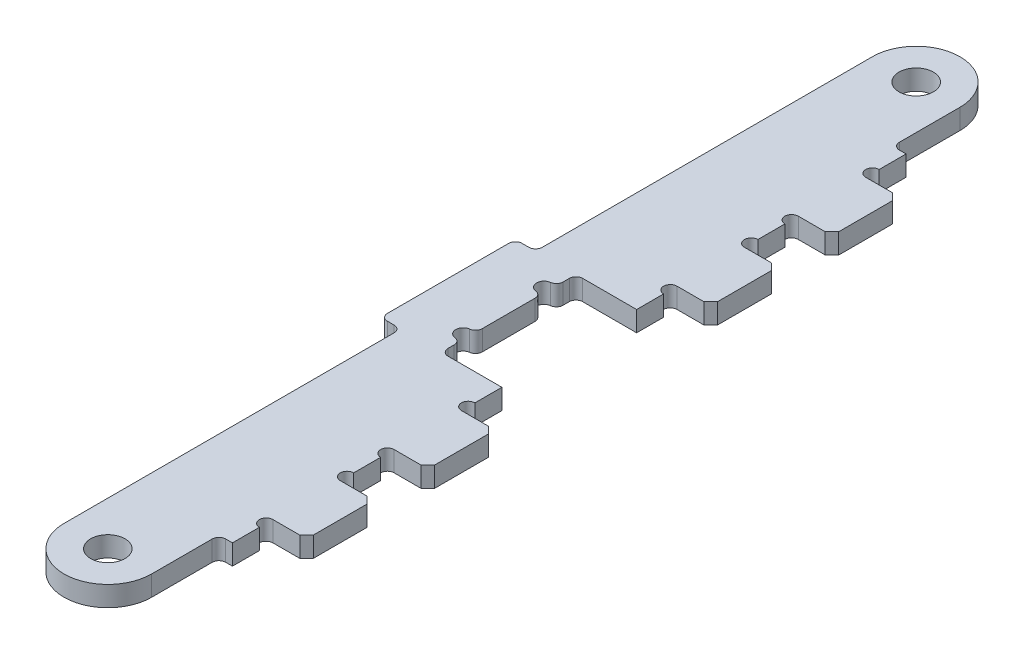
from build123d import *

# Parameters (mm, degrees)
SKETCH_1_R          = 6.5
SKETCH_1_R_2        = 2.55
SKETCH_1_W          = 3
SKETCH_1_H          = 20
EXTRUDE_1_DEPTH     = 3
FILLET_1_R          = 1
CHAMFER_1_SIZE      = 1
SKETCH_2_R          = 1.1
CUT_EXTRUDE_1_DEPTH = 68.922750239
FILLET_2_R          = 1


with BuildPart() as part:
    # 草图1 → 凸台-拉伸1 (new body)
    # profile 1 of 4: a face of its own
    with BuildSketch(Plane(origin=(0, 0, 0), x_dir=(1, 0, 0), z_dir=(0, 1, 0))):
        with BuildLine():
            ThreePointArc((6.5, 60), (0, 53.5), (-6.5, 60))
            Line((-6.5, 60), (-6.5, 10))
            Line((-6.5, 10), (-6.5, -10))
            Line((-6.5, -10), (-6.5, -60))
            ThreePointArc((-6.5, -60), (0, -53.5), (6.5, -60))
            Line((6.5, -60), (6.5, -50))
            Line((6.5, -50), (8.5, -50))
            Line((8.5, -50), (8.5, -46))
            ThreePointArc((8.5, -46), (7.5, -45), (8.5, -44))
            Line((8.5, -44), (13.5, -44))
            Line((13.5, -44), (13.5, -34))
            Line((13.5, -34), (8.5, -34))
            ThreePointArc((8.5, -34), (7.5, -33), (8.5, -32))
            Line((8.5, -32), (8.5, -28))
            ThreePointArc((8.5, -28), (7.5, -27), (8.5, -26))
            Line((8.5, -26), (13.5, -26))
            Line((13.5, -26), (13.5, -16))
            Line((13.5, -16), (8.5, -16))
            ThreePointArc((8.5, -16), (7.5, -15), (8.5, -14))
            Line((8.5, -14), (8.5, -10))
            Line((8.5, -10), (-0.5, -10))
            Line((-0.5, -10), (-0.5, 10))
            Line((-0.5, 10), (8.5, 10))
            Line((8.5, 10), (8.5, 14))
            ThreePointArc((8.5, 14), (7.5, 15), (8.5, 16))
            Line((8.5, 16), (13.5, 16))
            Line((13.5, 16), (13.5, 26))
            Line((13.5, 26), (8.5, 26))
            ThreePointArc((8.5, 26), (7.5, 27), (8.5, 28))
            Line((8.5, 28), (8.5, 32))
            ThreePointArc((8.5, 32), (7.5, 33), (8.5, 34))
            Line((8.5, 34), (13.5, 34))
            Line((13.5, 34), (13.5, 44))
            Line((13.5, 44), (8.5, 44))
            ThreePointArc((8.5, 44), (7.5, 45), (8.5, 46))
            Line((8.5, 46), (8.5, 50))
            Line((8.5, 50), (6.5, 50))
            Line((6.5, 50), (6.5, 60))
        make_face()
    # profile 2 of 4: a face of its own
    with BuildSketch(Plane(origin=(0, 0, 0), x_dir=(1, 0, 0), z_dir=(0, 1, 0))):
        with Locations((0, -60)):
            Circle(SKETCH_1_R)
        with Locations(Location((0, -60, 0), (0, 0, 270))):
            Circle(SKETCH_1_R_2, mode=Mode.SUBTRACT)
    # profile 3 of 4: a face of its own
    with BuildSketch(Plane(origin=(0, 0, 0), x_dir=(1, 0, 0), z_dir=(0, 1, 0))):
        with Locations((0, 60)):
            Circle(SKETCH_1_R)
        with Locations(Location((0, 60, 0), (0, 0, 270))):
            Circle(SKETCH_1_R_2, mode=Mode.SUBTRACT)
    # profile 4 of 4: a face of its own
    with BuildSketch(Plane(origin=(0, 0, 0), x_dir=(1, 0, 0), z_dir=(0, 1, 0))):
        with Locations((-8, 0)):
            Rectangle(SKETCH_1_W, SKETCH_1_H)
    extrude(amount=EXTRUDE_1_DEPTH)

    # 圆角1
    fillet_1_edges = [part.edges().sort_by_distance(p)[0] for p in [
        (6.5, 1.5, 50),
        (-6.5, 1.5, 10),
        (-9.5, 1.5, 10),
        (-9.5, 1.5, -10),
        (-6.5, 1.5, -10),
        (6.5, 1.5, -50),
        (-0.5, 1.5, -10),
        (-0.5, 1.5, 10),
    ]]
    fillet(fillet_1_edges, radius=FILLET_1_R)

    # 倒角1
    chamfer_1_edges = [part.edges().sort_by_distance(p)[0] for p in [
        (13.5, 1.5, 16),
        (13.5, 1.5, 26),
        (13.5, 1.5, 34),
        (13.5, 1.5, 44),
        (13.5, 1.5, -44),
        (13.5, 1.5, -34),
        (13.5, 1.5, -26),
        (13.5, 1.5, -16),
    ]]
    chamfer(chamfer_1_edges, length=CHAMFER_1_SIZE)

    # 草图2 → 切除-拉伸1 (cut, through all)
    with BuildSketch(Plane(origin=(0, 3, 0), x_dir=(1, 0, 0), z_dir=(0, 1, 0))):
        with Locations((6.75, 6)):
            Circle(SKETCH_2_R)
        with Locations((-1.25, 6)):
            Circle(SKETCH_2_R)
        with Locations((6.75, -6)):
            Circle(SKETCH_2_R)
        with Locations((-1.25, -6)):
            Circle(SKETCH_2_R)
    extrude(amount=-CUT_EXTRUDE_1_DEPTH, mode=Mode.SUBTRACT)

    # 圆角2
    fillet_2_edges = [part.edges().sort_by_distance(p)[0] for p in [
        (-0.5, 1.5, -6.804673847),
        (-0.5, 1.5, -5.195326153),
        (-0.5, 1.5, 5.195326153),
        (-0.5, 1.5, 6.804673847),
    ]]
    fillet(fillet_2_edges, radius=FILLET_2_R)


solid = part.part
